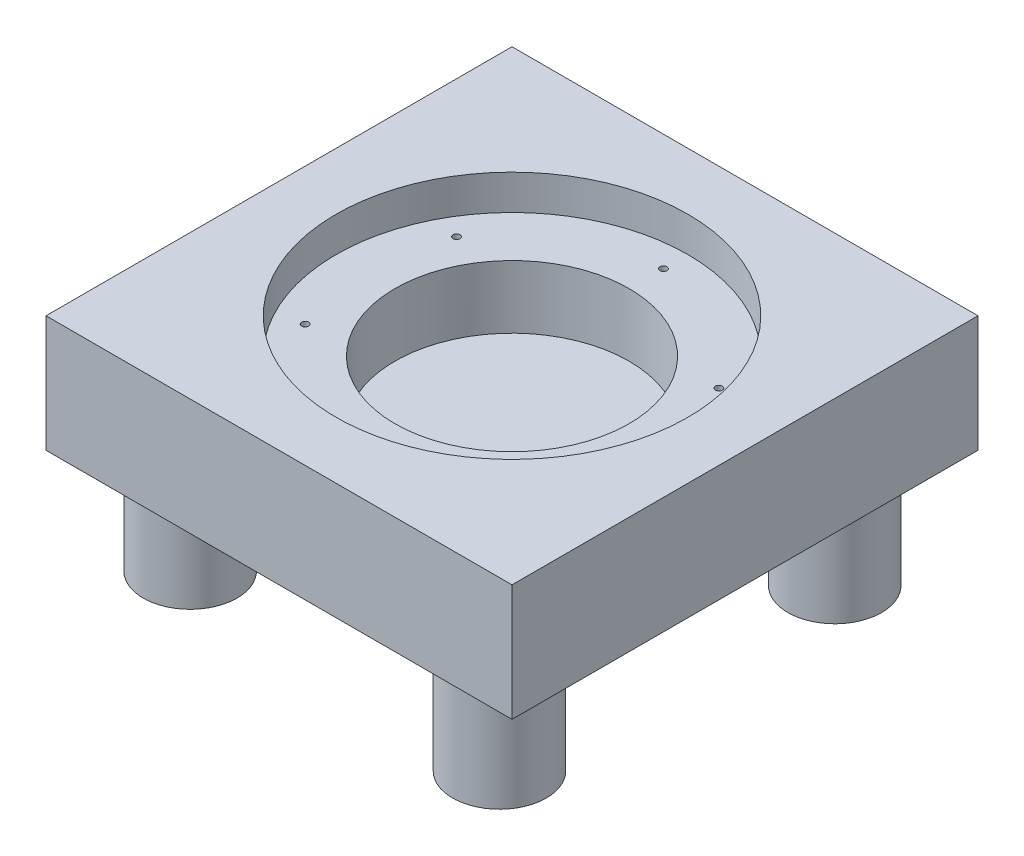
from build123d import *

# Parameters (mm, degrees)
SKETCH2_W               = 200
SKETCH2_H               = 200
BOSS_EXTRUDE1_DEPTH     = 50
CUT_EXTRUDE1_DEPTH      = 151
CUT_EXTRUDE1_DEPTH_BACK = 15
SKETCH5_R               = 75.5
CUT_EXTRUDE2_DEPTH      = 146.688022843
CUT_EXTRUDE2_DEPTH_BACK = 146.688022843
SKETCH7_R               = 50.25
SKETCH12_R              = 20.123320675
BOSS_EXTRUDE2_DEPTH     = 50
CIRPATTERN1_COUNT       = 4
CIRPATTERN1_ANGLE       = 276
SKETCH13_R              = 1.5
CUT_EXTRUDE3_DEPTH      = 10
CIRPATTERN2_COUNT       = 6
BOSS_EXTRUDE3_START     = -8
SKETCH14_R              = 50.25
BOSS_EXTRUDE3_DEPTH     = 8


with BuildPart() as part:
    # Sketch2 → Boss-Extrude1 (new body)
    with BuildSketch(Plane(origin=(0, 0, 0), x_dir=(1, 0, 0), z_dir=(0, 1, 0))):
        Rectangle(SKETCH2_W, SKETCH2_H)
    extrude(amount=BOSS_EXTRUDE1_DEPTH)

    # Sketch5 → Cut-Extrude1 (cut, two sides: drawn at the far end of the back side and taken through both)
    with BuildSketch(Plane(origin=(0, 50, 0), x_dir=(1, 0, 0), z_dir=(0, 1, 0)).offset(-CUT_EXTRUDE1_DEPTH_BACK)):
        with Locations(Location((0, 0, 0), (0, 0, 90))):
            Circle(SKETCH5_R)
    extrude(amount=CUT_EXTRUDE1_DEPTH + CUT_EXTRUDE1_DEPTH_BACK, mode=Mode.SUBTRACT)

    # Sketch7 → Cut-Extrude2 (cut, two sides: drawn at the far end of the back side and taken through both)
    with BuildSketch(Plane(origin=(0, 35, 0), x_dir=(1, 0, 0), z_dir=(0, 1, 0)).offset(-CUT_EXTRUDE2_DEPTH_BACK)):
        with Locations(Location((0, 0, 0), (0, 0, 270))):
            Circle(SKETCH7_R)
    extrude(amount=CUT_EXTRUDE2_DEPTH + CUT_EXTRUDE2_DEPTH_BACK, mode=Mode.SUBTRACT)

    # Sketch12 → Boss-Extrude2 (add)
    with BuildSketch(Plane.XZ):
        with Locations(Location((-74.168810486, 63.963412144, 0), (0, 0, 270))):
            Circle(SKETCH12_R)
    boss_extrude2 = extrude(amount=BOSS_EXTRUDE2_DEPTH)

    # CirPattern1: Boss-Extrude2 ×4 about axis
    cirpattern1_axis = Axis((0, 0, 0), (0, 1, 0))
    for i in range(1, CIRPATTERN1_COUNT):
        add(boss_extrude2.rotate(cirpattern1_axis, i * CIRPATTERN1_ANGLE / (CIRPATTERN1_COUNT - 1)))

    # Sketch13 → Cut-Extrude3 (cut)
    with BuildSketch(Plane(origin=(0, 35, 0), x_dir=(1, 0, 0), z_dir=(0, 1, 0))):
        with Locations(Location((0, 65, 0), (0, 0, 270))):
            Circle(SKETCH13_R)
    cut_extrude3 = extrude(amount=-CUT_EXTRUDE3_DEPTH, mode=Mode.SUBTRACT)

    # CirPattern2: Cut-Extrude3 ×6 about axis
    cirpattern2_axis = Axis((0, 0, 0), (0, 1, 0))
    for i in range(1, CIRPATTERN2_COUNT):
        add(cut_extrude3.rotate(cirpattern2_axis, i * 360 / CIRPATTERN2_COUNT), mode=Mode.SUBTRACT)

    # Sketch14 → Boss-Extrude3 (add)
    with BuildSketch(Plane.XZ.offset(BOSS_EXTRUDE3_START)):
        with Locations(Location((0, 0, 0), (0, 0, 90))):
            Circle(SKETCH14_R)
    extrude(amount=BOSS_EXTRUDE3_DEPTH)


solid = part.part
